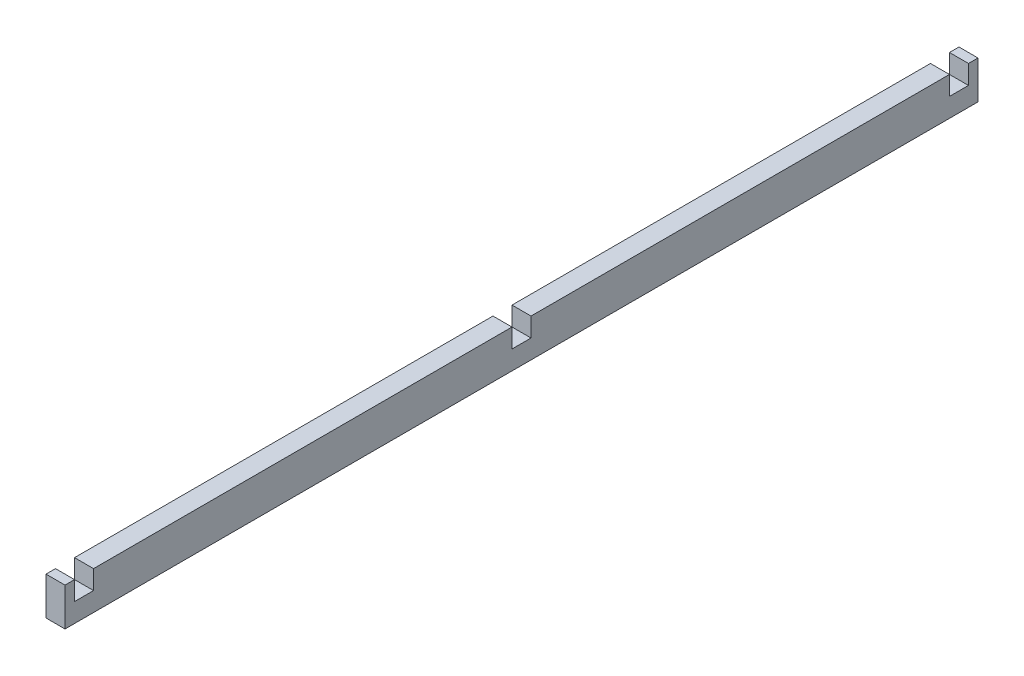
from build123d import *

# Parameters (mm, degrees)
SKETCH1_W               = 50.8
SKETCH1_H               = 101.6
BOSS_EXTRUDE1_DEPTH     = 2438.4
CUT_EXTRUDE1_DEPTH      = 2440.45810376
CUT_EXTRUDE1_DEPTH_BACK = 2440.45810376
SKETCH2_W               = 50.8
SKETCH2_H               = 50.8


with BuildPart() as part:
    # Sketch1 → Boss-Extrude1 (new body)
    with BuildSketch(Plane.XY):
        Rectangle(SKETCH1_W, SKETCH1_H)
    extrude(amount=BOSS_EXTRUDE1_DEPTH)

    # Sketch2 → Cut-Extrude1 (cut, two sides: drawn at the far end of the back side and taken through both)
    with BuildSketch(Plane(origin=(25.4, 0, 0), x_dir=(0, 0, -1), z_dir=(1, 0, 0)).offset(-CUT_EXTRUDE1_DEPTH_BACK)):
        with Locations((-1219.2, 25.4)):
            Rectangle(SKETCH2_W, SKETCH2_H)
        with Locations((-2387.6, 25.4)):
            Rectangle(SKETCH2_W, SKETCH2_H)
        with Locations((-50.8, 25.4)):
            Rectangle(SKETCH2_W, SKETCH2_H)
    extrude(amount=CUT_EXTRUDE1_DEPTH + CUT_EXTRUDE1_DEPTH_BACK, mode=Mode.SUBTRACT)


solid = part.part
